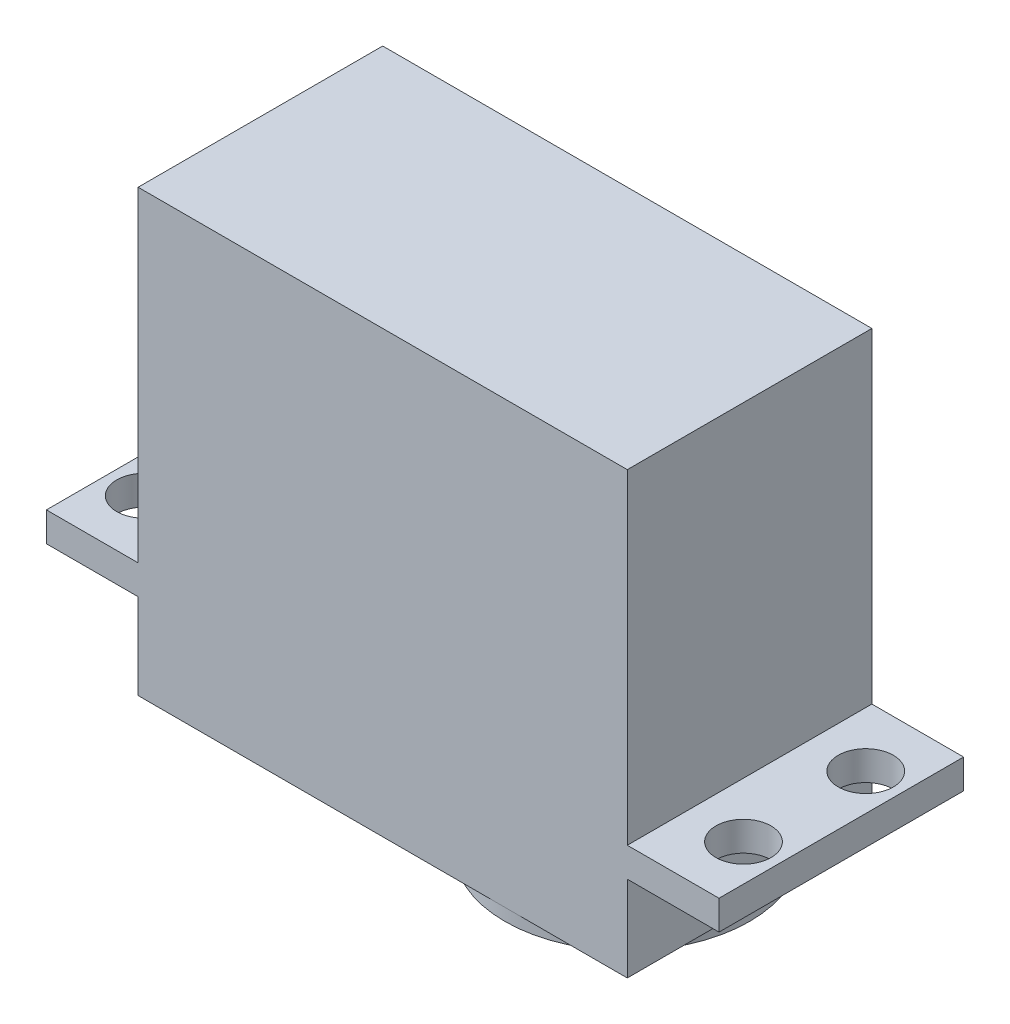
from build123d import *

# Parameters (mm, degrees)
SKETCH1_W            = 40
SKETCH1_H            = 20
BOSS_EXTRUDE1_DEPTH  = 36
SKETCH2_W            = 55
SKETCH2_H            = 20
BOSS_EXTRUDE2_DEPTH  = 2.4
M4_CLEARANCE_HOLE1_D = 4.5
SKETCH5_R            = 10
BOSS_EXTRUDE3_DEPTH  = 1


with BuildPart() as part:
    # Sketch1 → Boss-Extrude1 (new body)
    with BuildSketch(Plane(origin=(0, 0, 0), x_dir=(1, 0, 0), z_dir=(0, 1, 0))):
        Rectangle(SKETCH1_W, SKETCH1_H)
    extrude(amount=BOSS_EXTRUDE1_DEPTH)

    # Sketch2 → Boss-Extrude2 (add)
    with BuildSketch(Plane(origin=(0, 7, 0), x_dir=(1, 0, 0), z_dir=(0, 1, 0))):
        Rectangle(SKETCH2_W, SKETCH2_H)
    extrude(amount=BOSS_EXTRUDE2_DEPTH)

    # M4 Clearance Hole1 (through all)
    with Locations(Plane(origin=(0, 7, 0), x_dir=(-1, 0, 0), z_dir=(0, -1, 0))):
        with Locations((-24.5, 5), (-24.5, -5)):
            m4_clearance_hole1 = Hole(M4_CLEARANCE_HOLE1_D / 2)

    # Mirror1: M4 Clearance Hole1 across plane
    add(m4_clearance_hole1.mirror(Plane(origin=(0, 0, 0), x_dir=(0, 0, 1), z_dir=(1, 0, 0))), mode=Mode.SUBTRACT)

    # Sketch5 → Boss-Extrude3 (add)
    with BuildSketch(Plane.XZ):
        with Locations(Location((10, 0, 0), (0, 0, 270))):
            Circle(SKETCH5_R)
    extrude(amount=BOSS_EXTRUDE3_DEPTH)


solid = part.part
